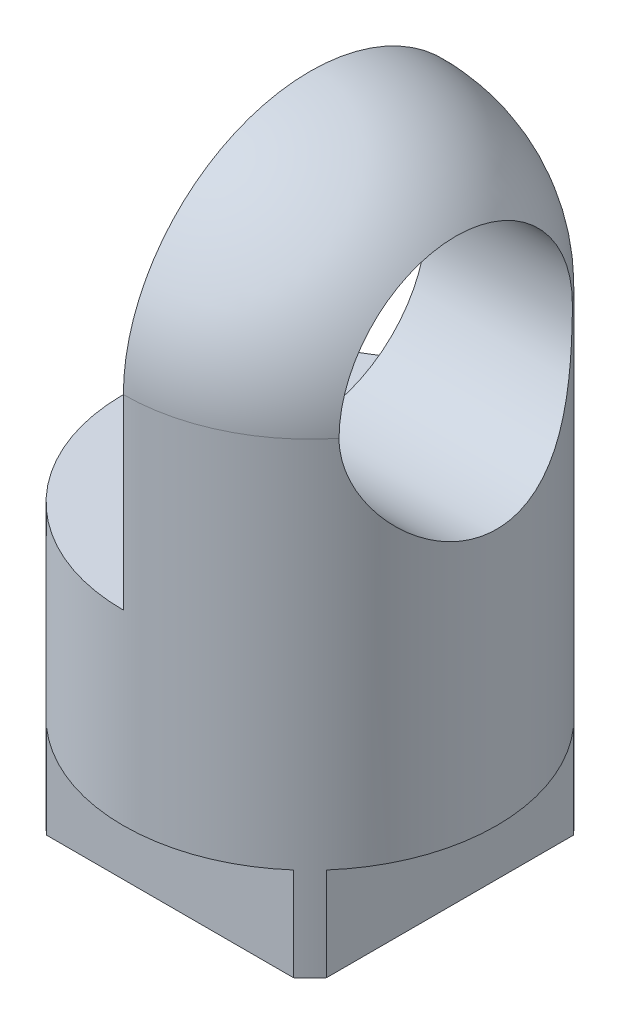
from build123d import *

# Parameters (mm, degrees)
CUT_EXTRUDE1_DEPTH      = 20.176579466
CUT_EXTRUDE1_DEPTH_BACK = 20.176579466
SKETCH2_R               = 3.175
CUT_EXTRUDE2_DEPTH      = 6.35
SKETCH3_R               = 3.175
CUT_EXTRUDE3_DEPTH      = 20.176579466
SKETCH4_R               = 13.063866327
SKETCH4_W               = 7.62
SKETCH4_H               = 7.62
CUT_EXTRUDE4_DEPTH      = 2.54


with BuildPart() as part:
    # Sketch1 → Revolve1 (revolve)
    with BuildSketch(Plane.XY):
        with BuildLine():
            Line((-5.08, 0), (0, 0))
            Line((0, 0), (0, 17.78))
            ThreePointArc((0, 17.78), (-3.592102448, 16.292102448), (-5.08, 12.7))
            Line((-5.08, 12.7), (-5.08, 0))
        make_face()
    revolve(axis=Axis((0, 12.7, 0), (0, -1, 0)))

    # Sketch1<3> → Cut-Extrude1 (cut, two sides: drawn at the far end of the back side and taken through both)
    with BuildSketch(Plane.XY.offset(-CUT_EXTRUDE1_DEPTH_BACK)):
        with BuildLine():
            Line((-5.08, 12.7), (-5.08, 7.62))
            Line((-5.08, 7.62), (0, 7.62))
            Line((0, 7.62), (0, 12.7))
            Line((0, 12.7), (0, 17.78))
            ThreePointArc((0, 17.78), (-3.592102448, 16.292102448), (-5.08, 12.7))
        make_face()
    extrude(amount=CUT_EXTRUDE1_DEPTH + CUT_EXTRUDE1_DEPTH_BACK, mode=Mode.SUBTRACT)

    # Sketch2 → Cut-Extrude2 (cut)
    with BuildSketch(Plane.XZ):
        Circle(SKETCH2_R)
    extrude(amount=-CUT_EXTRUDE2_DEPTH, mode=Mode.SUBTRACT)

    # Sketch3 → Cut-Extrude3 (cut, through all)
    with BuildSketch(Plane.ZY):
        with Locations((0, 12.7)):
            Circle(SKETCH3_R)
    extrude(amount=-CUT_EXTRUDE3_DEPTH, mode=Mode.SUBTRACT)

    # Sketch4 → Cut-Extrude4 (cut)
    with BuildSketch(Plane(origin=(0, 0, 0), x_dir=(1, 0, 0), z_dir=(0, 1, 0))):
        Circle(SKETCH4_R)
        Rectangle(SKETCH4_W, SKETCH4_H, mode=Mode.SUBTRACT)
    extrude(amount=CUT_EXTRUDE4_DEPTH, mode=Mode.SUBTRACT)


solid = part.part
